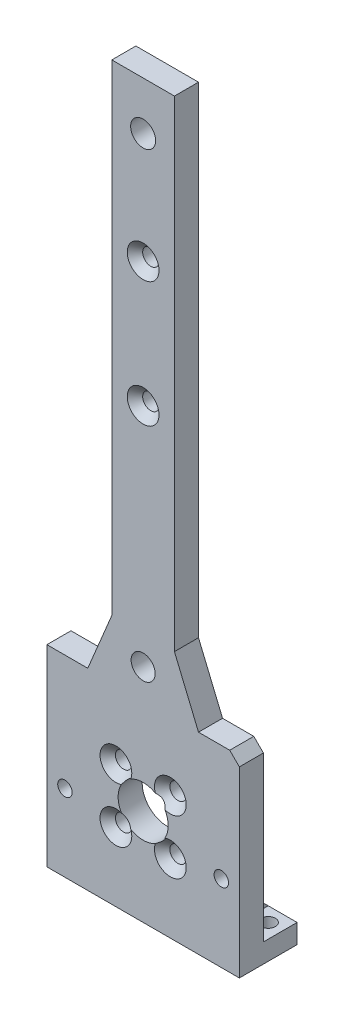
from build123d import *

# Parameters (mm, degrees)
SKETCH_1_W                   = 40
SKETCH_1_H                   = 40
SKETCH_1_R                   = 5.2
SKETCH_1_R_2                 = 1.6
EXTRUDE_1_DEPTH              = 5
HOLE_WIZARD_1_D              = 3
CHAMFER_1_SIZE               = 2
HOLE_WIZARD_M3_2_D           = 3.4
HOLE_WIZARD_M3_2_CSINK_D     = 6.6
HOLE_WIZARD_M3_2_CSINK_ANGLE = 90
SKETCH_7_R                   = 2.5
EXTRUDE_2_DEPTH              = 5
SKETCH_10_W                  = 9
SKETCH_10_H                  = 7
SKETCH_10_R                  = 1.5
EXTRUDE_4_DEPTH              = 4
EXTRUDE_6_DEPTH              = 3
SKETCH_13_W                  = 13.015545452
SKETCH_13_H                  = 100
SKETCH_13_R                  = 2.6
SKETCH_13_R_2                = 1.5
EXTRUDE_7_DEPTH              = 5
HOLE_WIZARD_M3_3_D           = 3.4
HOLE_WIZARD_M3_3_CSINK_D     = 6.6
HOLE_WIZARD_M3_3_CSINK_ANGLE = 90


with BuildPart() as part:
    # 草图1 → 凸台-拉伸1 (new body)
    with BuildSketch(Plane.XY):
        Rectangle(SKETCH_1_W, SKETCH_1_H)
        Circle(SKETCH_1_R, mode=Mode.SUBTRACT)
        with Locations((5.656854249, 5.656854249)):
            Circle(SKETCH_1_R_2, mode=Mode.SUBTRACT)
        with Locations((5.656854249, -5.656854249)):
            Circle(SKETCH_1_R_2, mode=Mode.SUBTRACT)
        with Locations((-5.656854249, -5.656854249)):
            Circle(SKETCH_1_R_2, mode=Mode.SUBTRACT)
        with Locations((-5.656854249, 5.656854249)):
            Circle(SKETCH_1_R_2, mode=Mode.SUBTRACT)
    extrude(amount=EXTRUDE_1_DEPTH)

    # 孔1 (through all)
    with Locations(Plane(origin=(16.25, -4, 5), x_dir=(1, 0, 0), z_dir=(0, 0, 1))):
        with Locations((0, 0), (-32.5, 0)):
            Hole(HOLE_WIZARD_1_D / 2)

    # 倒角1
    chamfer_1_edges = [part.edges().sort_by_distance(p)[0] for p in [
        (20, 20, 2.5),
    ]]
    chamfer(chamfer_1_edges, length=CHAMFER_1_SIZE)

    # M3 十字槽沉头木螺钉的锥形沉头孔2 (through all)
    with Locations(Plane.XY.offset(5)):
        with Locations((-5.656854249, 5.656854249), (5.656854249, 5.656854249), (5.656854249, -5.656854249), (-5.656854249, -5.656854249)):
            CounterSinkHole(HOLE_WIZARD_M3_2_D / 2, HOLE_WIZARD_M3_2_CSINK_D / 2, counter_sink_angle=HOLE_WIZARD_M3_2_CSINK_ANGLE)

    # 草图7 → 凸台-拉伸2 (add)
    with BuildSketch(Plane(origin=(0, 0, 0), x_dir=(-1, 0, 0), z_dir=(0, 0, -1))):
        Polygon((-11.507772726, 20), (-6.507772726, 20), (6.507772726, 20), (11.507772726, 20), (6.507772726, 32), (-6.507772726, 32), align=None)
        with Locations((0, 26)):
            Circle(SKETCH_7_R, mode=Mode.SUBTRACT)
    extrude(amount=-EXTRUDE_2_DEPTH)

    # 草图10 → 凸台-拉伸4 (add)
    with BuildSketch(Plane.XZ.offset(20)):
        with Locations((15.5, -3.5)):
            Rectangle(SKETCH_10_W, SKETCH_10_H)
        with Locations(Location((17, -4, 0), (0, 0, 270))):
            Circle(SKETCH_10_R, mode=Mode.SUBTRACT)
    extrude_4 = extrude(amount=-EXTRUDE_4_DEPTH)

    # 草图12 → 凸台-拉伸6 (add)
    with BuildSketch(Plane.ZY.offset(-11)):
        Polygon((-7, -16), (0, -9), (0, -16), align=None)
    extrude_6 = extrude(amount=-EXTRUDE_6_DEPTH)

    # 镜向2: 凸台-拉伸4, 凸台-拉伸6 across plane
    add(extrude_4.mirror(Plane(origin=(0, 0, 0), x_dir=(0, 0, 1), z_dir=(1, 0, 0))))
    add(extrude_6.mirror(Plane(origin=(0, 0, 0), x_dir=(0, 0, 1), z_dir=(1, 0, 0))))

    # 草图13 → 凸台-拉伸7 (add)
    with BuildSketch(Plane.XY.offset(5)):
        with Locations((0, 82)):
            Rectangle(SKETCH_13_W, SKETCH_13_H)
        with Locations((0, 122)):
            Circle(SKETCH_13_R, mode=Mode.SUBTRACT)
        with Locations((0, 99)):
            Circle(SKETCH_13_R_2, mode=Mode.SUBTRACT)
        with Locations((0, 73)):
            Circle(SKETCH_13_R_2, mode=Mode.SUBTRACT)
    extrude(amount=-EXTRUDE_7_DEPTH)

    # M3 十字槽沉头木螺钉的锥形沉头孔3 (through all)
    with Locations(Plane.XY.offset(5)):
        with Locations((0, 99), (0, 73)):
            CounterSinkHole(HOLE_WIZARD_M3_3_D / 2, HOLE_WIZARD_M3_3_CSINK_D / 2, counter_sink_angle=HOLE_WIZARD_M3_3_CSINK_ANGLE)


solid = part.part
